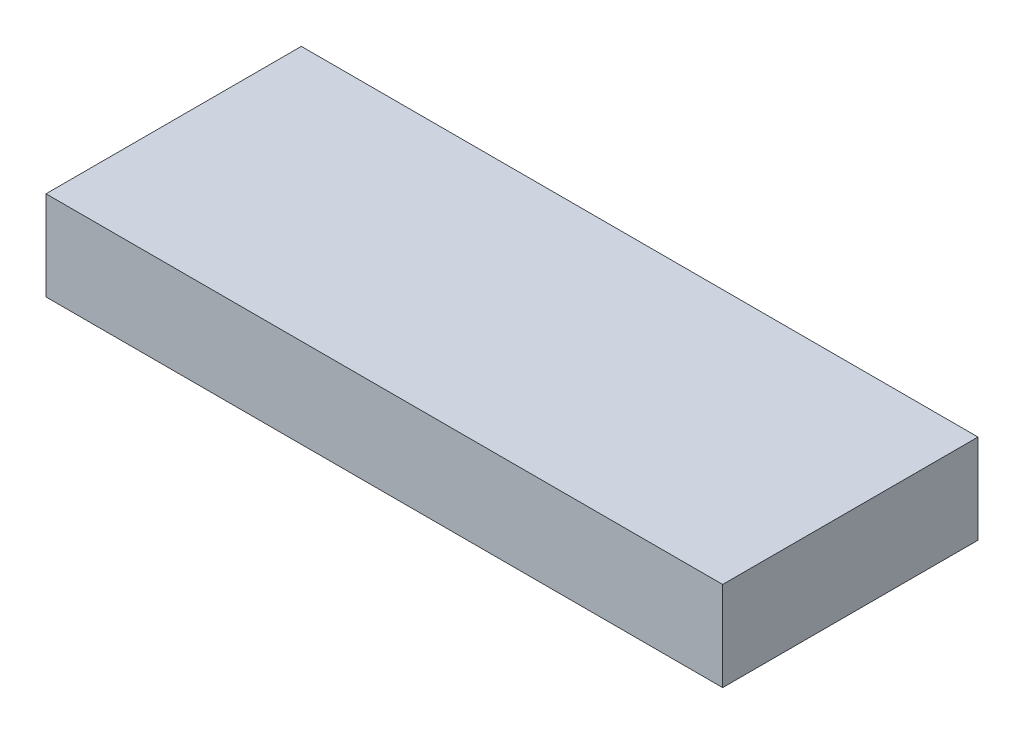
from build123d import *

# Parameters (mm, degrees)
SKETCH1_W           = 168.275
SKETCH1_H           = 63.5
BOSS_EXTRUDE1_DEPTH = 22.225


with BuildPart() as part:
    # Sketch1 → Boss-Extrude1 (new body)
    with BuildSketch(Plane(origin=(0, 0, 0), x_dir=(1, 0, 0), z_dir=(0, 1, 0))):
        with Locations((84.1375, 31.75)):
            Rectangle(SKETCH1_W, SKETCH1_H)
    extrude(amount=BOSS_EXTRUDE1_DEPTH)


solid = part.part
